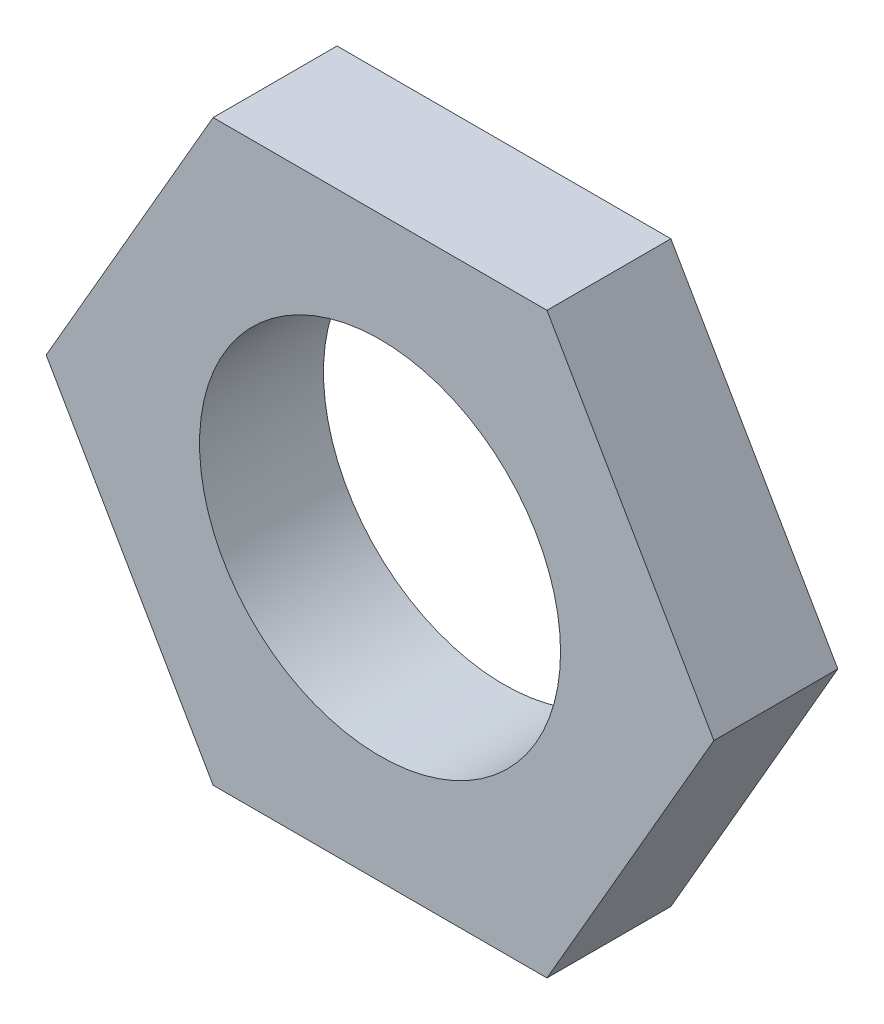
from build123d import *

# Parameters (mm, degrees)
SKETCH1_R           = 2.185
BOSS_EXTRUDE1_DEPTH = 1.5


with BuildPart() as part:
    # Sketch1 → Boss-Extrude1 (new body)
    with BuildSketch(Plane.XY):
        Polygon((4.041451884, 0), (2.020725942, 3.5), (-2.020725942, 3.5), (-4.041451884, 0), (-2.020725942, -3.5), (2.020725942, -3.5), align=None)
        Circle(SKETCH1_R, mode=Mode.SUBTRACT)
    extrude(amount=BOSS_EXTRUDE1_DEPTH)


solid = part.part
